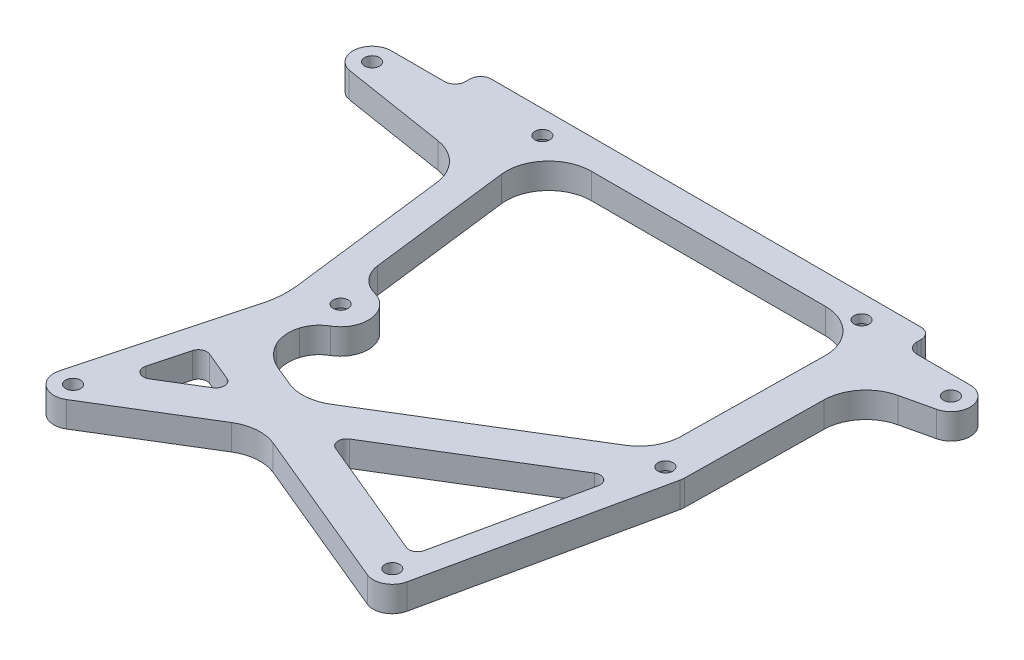
from build123d import *

# Parameters (mm, degrees)
SKETCH_1_R          = 1.75
EXTRUDE_1_DEPTH     = 6
SKETCH_2_R          = 3
CUT_EXTRUDE_1_DEPTH = 4


with BuildPart() as part:
    # Эскиз1 → Бобышка-Вытянуть1 (new body)
    with BuildSketch(Plane(origin=(0, 0, 0), x_dir=(1, 0, 0), z_dir=(0, 1, 0))):
        with BuildLine():
            Line((0, 105.25), (12.5, 105.25))
            ThreePointArc((12.5, 105.25), (14.267766953, 105.982233047), (15, 107.75))
            Line((15, 107.75), (15, 108.75))
            ThreePointArc((15, 108.75), (15.732233047, 110.517766953), (17.5, 111.25))
            Line((17.5, 111.25), (118.5, 111.25))
            ThreePointArc((118.5, 111.25), (120.267766953, 110.517766953), (121, 108.75))
            Line((121, 108.75), (121, 107.75))
            ThreePointArc((121, 107.75), (121.732233047, 105.982233047), (123.5, 105.25))
            Line((123.5, 105.25), (136, 105.25))
            ThreePointArc((136, 105.25), (140.471073351, 101.259414462), (137.012279745, 96.365334708))
            Line((137.012279745, 96.365334708), (129.613763077, 94.657252548))
            ThreePointArc((129.613763077, 94.657252548), (124.08407631, 91.197188523), (121.864397453, 85.063469865))
            Line((121.864397453, 85.063469865), (121.379494275, 52.722536916))
            ThreePointArc((121.379494275, 52.722536916), (121.35096588, 52.279643163), (121.278949063, 51.841713576))
            Line((121.278949063, 51.841713576), (109.898949063, -0.948286424))
            ThreePointArc((109.898949063, -0.948286424), (107.58711076, -3.986724053), (103.772892877, -4.155370138))
            Line((103.772892877, -4.155370138), (65.954927395, 11.563007621))
            ThreePointArc((65.954927395, 11.563007621), (61.344389675, 12.298967601), (56.902251647, 10.861572422))
            Line((56.902251647, 10.861572422), (32.846596964, -3.839724299))
            ThreePointArc((32.846596964, -3.839724299), (27.805357329, -3.604011776), (26.153333782, 1.164685703))
            Line((26.153333782, 1.164685703), (36.221084572, 38.73804317))
            ThreePointArc((36.221084572, 38.73804317), (36.853849051, 42.519294597), (36.753491079, 46.35181094))
            Line((36.753491079, 46.35181094), (32.158216583, 83.777318367))
            ThreePointArc((32.158216583, 83.777318367), (29.42615307, 89.505208638), (23.797099717, 92.435508339))
            Line((23.797099717, 92.435508339), (-1.006615848, 96.364030947))
            ThreePointArc((-1.006615848, 96.364030947), (-4.471401388, 101.256527029), (0, 105.25))
        make_face()
        with Locations(Location((35, 105.75, 0), (0, 0, 270))):
            Circle(SKETCH_1_R, mode=Mode.SUBTRACT)
        with Locations(Location((110, 105.75, 0), (0, 0, 270))):
            Circle(SKETCH_1_R, mode=Mode.SUBTRACT)
        with Locations(Location((116.88, 52.79, 0), (0, 0, 270))):
            Circle(SKETCH_1_R, mode=Mode.SUBTRACT)
        with Locations(Location((45.62, 47.74, 0), (0, 0, 270))):
            Circle(SKETCH_1_R, mode=Mode.SUBTRACT)
        with Locations(Location((0, 100.75, 0), (0, 0, 270))):
            Circle(SKETCH_1_R, mode=Mode.SUBTRACT)
        with Locations(Location((136, 100.75, 0), (0, 0, 270))):
            Circle(SKETCH_1_R, mode=Mode.SUBTRACT)
        with Locations(Location((30.5, 0, 0), (0, 0, 270))):
            Circle(SKETCH_1_R, mode=Mode.SUBTRACT)
        with Locations(Location((105.5, 0, 0), (0, 0, 270))):
            Circle(SKETCH_1_R, mode=Mode.SUBTRACT)
        with BuildLine():
            Line((48, 104.25), (103, 104.25))
            ThreePointArc((103, 104.25), (110.123874635, 101.267863648), (112.998876167, 94.100082036))
            Line((112.998876167, 94.100082036), (112.500284745, 60.846202729))
            ThreePointArc((112.500284745, 60.846202729), (111.186497255, 56.039384402), (107.716068497, 52.46340003))
            Line((107.716068497, 52.46340003), (64.817208881, 26.246326643))
            ThreePointArc((64.817208881, 26.246326643), (60.375070853, 24.808931464), (55.764533132, 25.544891444))
            Line((55.764533132, 25.544891444), (51.232831469, 27.428414202))
            ThreePointArc((51.232831469, 27.428414202), (48.311891769, 29.292595834), (46.202504042, 32.041694834))
            ThreePointArc((46.202504042, 32.041694834), (45.33035863, 35.010535959), (45.650081265, 38.088267701))
            ThreePointArc((45.650081265, 38.088267701), (46.871495682, 40.400347733), (48.856177376, 42.102876976))
            ThreePointArc((48.856177376, 42.102876976), (52.06452504, 48.587406051), (47.288889887, 54.02210208))
            ThreePointArc((47.288889887, 54.02210208), (43.80810358, 56.18938194), (42.138332857, 59.934357378))
            Line((42.138332857, 59.934357378), (38.074538484, 93.031306566))
            ThreePointArc((38.074538484, 93.031306566), (40.510442792, 100.876200482), (48, 104.25))
        make_face(mode=Mode.SUBTRACT)
        with BuildLine():
            Line((112.820087132, 41.07481604), (105.561751128, 7.404556143))
            ThreePointArc((105.561751128, 7.404556143), (104.534267438, 6.054139419), (102.83905949, 5.979185604))
            Line((102.83905949, 5.979185604), (74.366820735, 17.81317505))
            ThreePointArc((74.366820735, 17.81317505), (73.140400732, 19.505501844), (74.091491917, 21.366550355))
            Line((74.091491917, 21.366550355), (109.822066675, 43.202820805))
            ThreePointArc((109.822066675, 43.202820805), (112.022629186, 43.127194072), (112.820087132, 41.07481604))
        make_face(mode=Mode.SUBTRACT)
        with BuildLine():
            Line((47.62796861, 15.74134871), (38.316811752, 10.050957756))
            ThreePointArc((38.316811752, 10.050957756), (36.076260803, 10.155718878), (35.342028115, 12.275139979))
            Line((35.342028115, 12.275139979), (37.647028294, 20.87751776))
            ThreePointArc((37.647028294, 20.87751776), (38.695388466, 22.154160251), (40.346483113, 22.206710843))
            Line((40.346483113, 22.206710843), (47.352639792, 19.294724015))
            ThreePointArc((47.352639792, 19.294724015), (48.579059795, 17.602397221), (47.62796861, 15.74134871))
        make_face(mode=Mode.SUBTRACT)
    extrude(amount=EXTRUDE_1_DEPTH)

    # Эскиз2 → Вырез-Вытянуть1 (cut)
    with BuildSketch(Plane(origin=(0, 0, 0), x_dir=(-1, 0, 0), z_dir=(0, -1, 0))):
        with Locations(Location((-110, 105.75, 0), (0, 0, 90))):
            Circle(SKETCH_2_R)
        with Locations(Location((-35, 105.75, 0), (0, 0, 90))):
            Circle(SKETCH_2_R)
        with Locations(Location((-116.88, 52.79, 0), (0, 0, 90))):
            Circle(SKETCH_2_R)
        with Locations(Location((-45.62, 47.74, 0), (0, 0, 90))):
            Circle(SKETCH_2_R)
    extrude(amount=-CUT_EXTRUDE_1_DEPTH, mode=Mode.SUBTRACT)


solid = part.part
